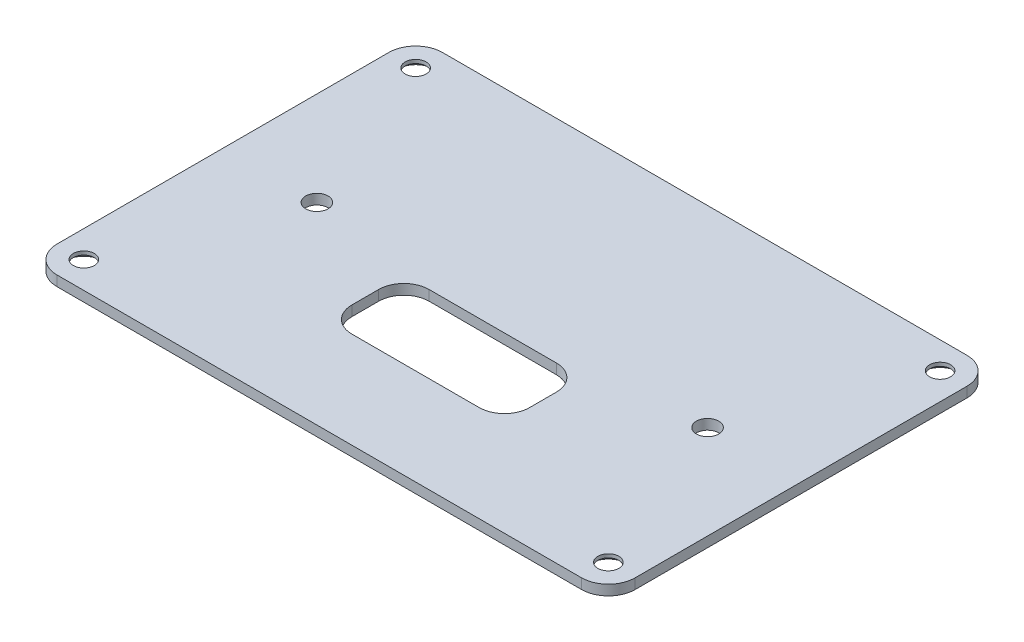
from build123d import *

# Parameters (mm, degrees)
SKETCH2_R                                 = 1
BOSS_EXTRUDE3_DEPTH                       = 1.5875
DB15_PLUG_CUTAWAY_DEPTH                   = 55.106562968
CSK_FOR_4_FLAT_HEAD_MACHINE_SCREW_2_COUNT = 2
CSK_FOR_4_FLAT_HEAD_MACHINE_SCREW_2_PITCH = 51.65
CSK_FOR_4_FLAT_HEAD_MACHINE_SCREW_3_COUNT = 2
CSK_FOR_4_FLAT_HEAD_MACHINE_SCREW_3_PITCH = 81.65
CSK_FOR_4_FLAT_HEAD_MACHINE_SCREW_4_COUNT = 2
CSK_FOR_4_FLAT_HEAD_MACHINE_SCREW_4_PITCH = 96.614931558
SKETCH11_R                                = 1.7399
CUT_EXTRUDE1_DEPTH                        = 55.106562968


with BuildPart() as part:
    # Sketch2 → Boss-Extrude3 (new body)
    with BuildSketch(Plane(origin=(0, 0, 0), x_dir=(1, 0, 0), z_dir=(0, 1, 0))):
        with BuildLine():
            Line((-45, 25.825), (-45, -25.825))
            ThreePointArc((-45, -25.825), (-43.777170811, -28.777170811), (-40.825, -30))
            Line((-40.825, -30), (40.825, -30))
            ThreePointArc((40.825, -30), (43.777170811, -28.777170811), (45, -25.825))
            Line((45, -25.825), (45, 25.825))
            ThreePointArc((45, 25.825), (43.777170811, 28.777170811), (40.825, 30))
            Line((40.825, 30), (-40.825, 30))
            ThreePointArc((-40.825, 30), (-43.777170811, 28.777170811), (-45, 25.825))
        make_face()
        with Locations(Location((40.825, 25.825, 0), (0, 0, 270))):
            Circle(SKETCH2_R, mode=Mode.SUBTRACT)
        with Locations(Location((-40.825, 25.825, 0), (0, 0, 270))):
            Circle(SKETCH2_R, mode=Mode.SUBTRACT)
        with Locations(Location((-40.825, -25.825, 0), (0, 0, 270))):
            Circle(SKETCH2_R, mode=Mode.SUBTRACT)
        with Locations(Location((40.825, -25.825, 0), (0, 0, 270))):
            Circle(SKETCH2_R, mode=Mode.SUBTRACT)
    extrude(amount=BOSS_EXTRUDE3_DEPTH)

    # Sketch4 → DB15 Plug Cutaway (cut, through all)
    with BuildSketch(Plane.XZ):
        with BuildLine():
            Line((-13.835, 6.924614493), (-13.835, 11.090214492))
            ThreePointArc((-13.835, 11.090214492), (-12.684222543, 13.868437036), (-9.905999998, 15.019214492))
            Line((-9.905999998, 15.019214492), (9.905999999, 15.019214492))
            ThreePointArc((9.905999999, 15.019214492), (12.684222543, 13.868437035), (13.835, 11.090214492))
            Line((13.835, 11.090214492), (13.835, 6.924614492))
            ThreePointArc((13.835, 6.924614492), (12.684222543, 4.146391949), (9.906, 2.995614492))
            Line((9.906, 2.995614492), (-9.905999998, 2.995614492))
            ThreePointArc((-9.905999998, 2.995614492), (-12.684222543, 4.146391948), (-13.835, 6.924614493))
        make_face()
    extrude(amount=-DB15_PLUG_CUTAWAY_DEPTH, mode=Mode.SUBTRACT)

    # Sketch9 → CSK for #4 Flat Head Machine Screw (100)2 (revolve, cut)
    with BuildSketch(Plane(origin=(-40.825, 0, 25.825), x_dir=(0, 0, -1), z_dir=(1, 0, 0))):
        Polygon((0, 0), (0, 1.5875), (1.63195, 1.5875), (1.63195, 1.028358553), (2.8575, 0), align=None)
    csk_for_4_flat_head_machine_screw_100 = revolve(axis=Axis((-40.825, -6.35, 25.825), (0, 1, 0)), mode=Mode.SUBTRACT)

    # CSK for _4 Flat Head Machine Screw _ 2: CSK for #4 Flat Head Machine Screw (100)2 ×2
    with Locations(*[(0, 0, -i * CSK_FOR_4_FLAT_HEAD_MACHINE_SCREW_2_PITCH) for i in range(1, CSK_FOR_4_FLAT_HEAD_MACHINE_SCREW_2_COUNT)]):
        add(csk_for_4_flat_head_machine_screw_100, mode=Mode.SUBTRACT)

    # CSK for _4 Flat Head Machine Screw _ 3: CSK for #4 Flat Head Machine Screw (100)2 ×2
    with Locations(*[(i * CSK_FOR_4_FLAT_HEAD_MACHINE_SCREW_3_PITCH, 0, 0) for i in range(1, CSK_FOR_4_FLAT_HEAD_MACHINE_SCREW_3_COUNT)]):
        add(csk_for_4_flat_head_machine_screw_100, mode=Mode.SUBTRACT)

    # CSK for _4 Flat Head Machine Screw _ 4: CSK for #4 Flat Head Machine Screw (100)2 ×2
    with Locations(*[Vector(0.8451074661352507, 0, -0.5345964559202167) * (i * CSK_FOR_4_FLAT_HEAD_MACHINE_SCREW_4_PITCH) for i in range(1, CSK_FOR_4_FLAT_HEAD_MACHINE_SCREW_4_COUNT)]):
        add(csk_for_4_flat_head_machine_screw_100, mode=Mode.SUBTRACT)

    # Sketch11 → Cut-Extrude1 (cut, through all)
    with BuildSketch(Plane.XZ):
        with Locations(Location((-30.382, -0.009017528, 0), (0, 0, 270))):
            Circle(SKETCH11_R)
        with Locations(Location((30.382, -0.061487226, 0), (0, 0, 270))):
            Circle(SKETCH11_R)
    extrude(amount=-CUT_EXTRUDE1_DEPTH, mode=Mode.SUBTRACT)


solid = part.part
